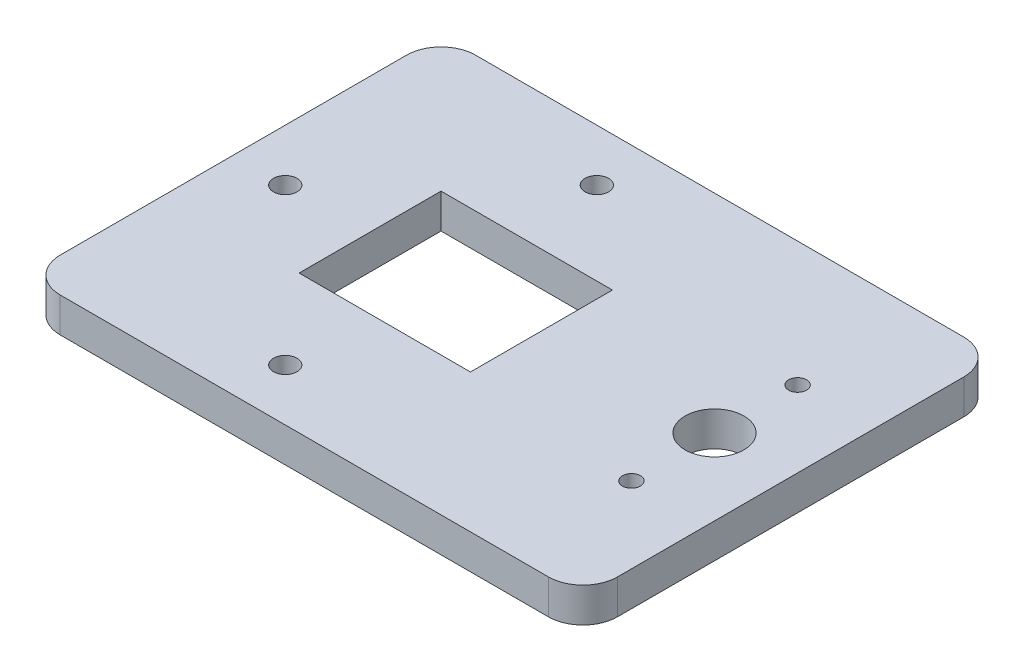
from build123d import *

# Parameters (mm, degrees)
SKETCH_1_W          = 161
SKETCH_1_H          = 120
EXTRUDE_1_DEPTH     = 10
FILLET_1_R          = 10
SKETCH_2_W          = 49.5
SKETCH_2_H          = 41
CUT_EXTRUDE_1_DEPTH = 10
SKETCH_3_R          = 8.5
CUT_EXTRUDE_2_DEPTH = 10
FILLET_2_R          = 10
SKETCH_5_R          = 3.4
CUT_EXTRUDE_4_DEPTH = 118.474465311
SKETCH_6_R          = 2.6
CUT_EXTRUDE_5_DEPTH = 10


with BuildPart() as part:
    # 草图1 → 凸台-拉伸1 (new body)
    with BuildSketch(Plane(origin=(0, 0, 0), x_dir=(1, 0, 0), z_dir=(0, 1, 0))):
        with Locations((-20, 0)):
            Rectangle(SKETCH_1_W, SKETCH_1_H)
    extrude(amount=EXTRUDE_1_DEPTH)

    # 圆角1
    fillet_1_edges = [part.edges().sort_by_distance(p)[0] for p in [
        (60.5, 5, 60),
        (60.5, 5, -60),
    ]]
    fillet(fillet_1_edges, radius=FILLET_1_R)

    # 草图2 → 切除-拉伸1 (cut)
    with BuildSketch(Plane(origin=(0, 10, 0), x_dir=(1, 0, 0), z_dir=(0, 1, 0))):
        with Locations((-36.75, 0.5)):
            Rectangle(SKETCH_2_W, SKETCH_2_H)
    extrude(amount=-CUT_EXTRUDE_1_DEPTH, mode=Mode.SUBTRACT)

    # 草图3 → 切除-拉伸2 (cut)
    with BuildSketch(Plane(origin=(0, 10, 0), x_dir=(1, 0, 0), z_dir=(0, 1, 0))):
        with Locations(Location((38.5, 0, 0), (0, 0, 270))):
            Circle(SKETCH_3_R)
    extrude(amount=-CUT_EXTRUDE_2_DEPTH, mode=Mode.SUBTRACT)

    # 圆角2
    fillet_2_edges = [part.edges().sort_by_distance(p)[0] for p in [
        (-100.5, 5, 60),
        (-100.5, 5, -60),
    ]]
    fillet(fillet_2_edges, radius=FILLET_2_R)

    # 草图5 → 切除-拉伸4 (cut, through all)
    with BuildSketch(Plane.XZ):
        with Locations(Location((-40.5, 45, 0), (0, 0, 270))):
            Circle(SKETCH_5_R)
        with Locations(Location((-85.5, 0, 0), (0, 0, 270))):
            Circle(SKETCH_5_R)
        with Locations(Location((-40.5, -45, 0), (0, 0, 270))):
            Circle(SKETCH_5_R)
    extrude(amount=-CUT_EXTRUDE_4_DEPTH, mode=Mode.SUBTRACT)

    # 草图6 → 切除-拉伸5 (cut)
    with BuildSketch(Plane(origin=(0, 10, 0), x_dir=(1, 0, 0), z_dir=(0, 1, 0))):
        with Locations(Location((38.5, 24, 0), (0, 0, 270))):
            Circle(SKETCH_6_R)
        with Locations(Location((38.5, -24, 0), (0, 0, 270))):
            Circle(SKETCH_6_R)
    extrude(amount=-CUT_EXTRUDE_5_DEPTH, mode=Mode.SUBTRACT)


solid = part.part
